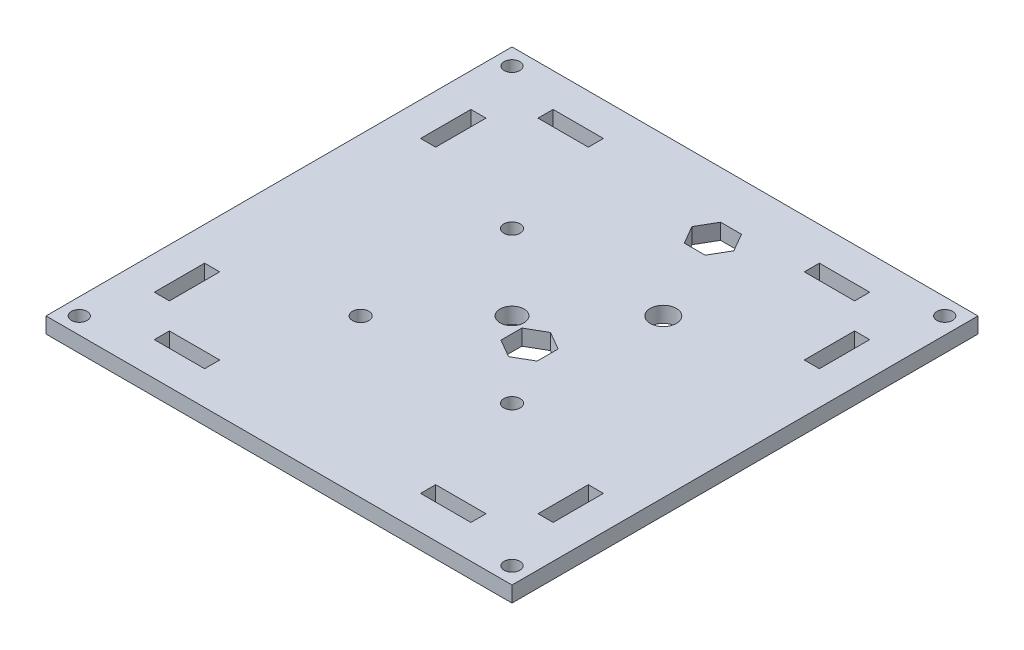
from build123d import *

# Parameters (mm, degrees)
SKETCH_2_W          = 88.9
SKETCH_2_H          = 3
EXTRUDE_1_DEPTH     = 88.9
SKETCH_4_R          = 1.5
SKETCH_4_W          = 2.88
SKETCH_4_H          = 9.6
SKETCH_4_W_2        = 9.6
SKETCH_4_H_2        = 2.88
CUT_EXTRUDE_1_DEPTH = 3
SKETCH_5_R          = 1.56
CUT_EXTRUDE_2_DEPTH = 3
SKETCH_7_R          = 2.495
CUT_EXTRUDE_3_DEPTH = 3
SKETCH_8_R          = 2.286
CUT_EXTRUDE_4_DEPTH = 3


with BuildPart() as part:
    # 스케치2 → 보스-돌출1 (new body)
    with BuildSketch(Plane.XY):
        Rectangle(SKETCH_2_W, SKETCH_2_H)
    extrude(amount=EXTRUDE_1_DEPTH)

    # 스케치4 → 컷-돌출1 (cut)
    with BuildSketch(Plane(origin=(0, 1.5, 0), x_dir=(1, 0, 0), z_dir=(0, 1, 0))):
        with Locations(Location((-41.275, -85.725, 0), (0, 0, 270))):
            Circle(SKETCH_4_R)
        with Locations(Location((-41.275, -3.175, 0), (0, 0, 270))):
            Circle(SKETCH_4_R)
        with Locations(Location((41.275, -3.175, 0), (0, 0, 270))):
            Circle(SKETCH_4_R)
        with Locations(Location((41.275, -85.725, 0), (0, 0, 270))):
            Circle(SKETCH_4_R)
        with Locations((-36.6, -69.85)):
            Rectangle(SKETCH_4_W, SKETCH_4_H)
        with Locations((-36.6, -19.05)):
            Rectangle(SKETCH_4_W, SKETCH_4_H)
        with Locations((-25.4, -7.85)):
            Rectangle(SKETCH_4_W_2, SKETCH_4_H_2)
        with Locations((36.6, -69.85)):
            Rectangle(SKETCH_4_W, SKETCH_4_H)
        with Locations((36.6, -19.05)):
            Rectangle(SKETCH_4_W, SKETCH_4_H)
        with Locations((25.4, -7.85)):
            Rectangle(SKETCH_4_W_2, SKETCH_4_H_2)
        with Locations((25.4, -81.05)):
            Rectangle(SKETCH_4_W_2, SKETCH_4_H_2)
        with Locations((-25.4, -81.05)):
            Rectangle(SKETCH_4_W_2, SKETCH_4_H_2)
    extrude(amount=-CUT_EXTRUDE_1_DEPTH, mode=Mode.SUBTRACT)

    # 스케치5 → 컷-돌출2 (cut)
    with BuildSketch(Plane(origin=(0, 1.5, 0), x_dir=(1, 0, 0), z_dir=(0, 1, 0))):
        with Locations(Location((-14.431818182, -30.018181818, 0), (0, 0, 270))):
            Circle(SKETCH_5_R)
        with Locations(Location((14.431818182, -30.018181818, 0), (0, 0, 270))):
            Circle(SKETCH_5_R)
        with Locations(Location((14.431818182, -58.881818182, 0), (0, 0, 270))):
            Circle(SKETCH_5_R)
        with Locations(Location((-14.431818182, -58.881818182, 0), (0, 0, 270))):
            Circle(SKETCH_5_R)
    extrude(amount=-CUT_EXTRUDE_2_DEPTH, mode=Mode.SUBTRACT)

    # 스케치7 → 컷-돌출3 (cut)
    with BuildSketch(Plane(origin=(0, 1.5, 0), x_dir=(1, 0, 0), z_dir=(0, 1, 0))):
        with Locations(Location((14.431818182, -30.018181818, 0), (0, 0, 270))):
            Circle(SKETCH_7_R)
        Polygon((6.401818182, -51.503445681), (2.941818182, -49.50581375), (2.941818182, -45.510549887), (6.401818182, -43.512917955), (9.861818182, -45.510549887), (9.861818182, -49.50581375), align=None)
        Polygon((4.40418625, -15.988181818), (2.406554319, -12.528181818), (4.40418625, -9.068181818), (8.399450113, -9.068181818), (10.397082045, -12.528181818), (8.399450113, -15.988181818), align=None)
    extrude(amount=-CUT_EXTRUDE_3_DEPTH, mode=Mode.SUBTRACT)

    # 스케치8 → 컷-돌출4 (cut)
    with BuildSketch(Plane(origin=(0, 1.5, 0), x_dir=(1, 0, 0), z_dir=(0, 1, 0))):
        with Locations(Location((0, -44.45, 0), (0, 0, 270))):
            Circle(SKETCH_8_R)
    extrude(amount=-CUT_EXTRUDE_4_DEPTH, mode=Mode.SUBTRACT)


solid = part.part
